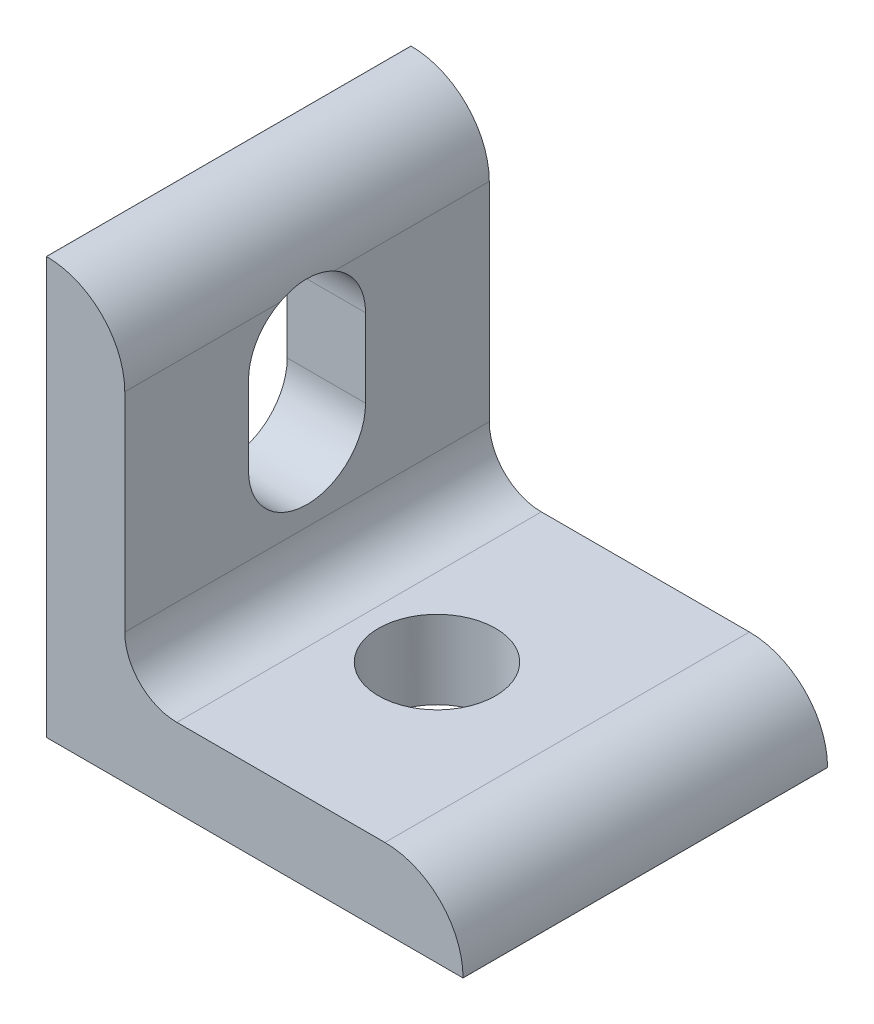
from build123d import *

# Parameters (mm, degrees)
BOSS_EXTRUDE1_DEPTH = 11.1125
CUT_EXTRUDE1_REACH  = 39.601
SKETCH4_R           = 3.5687
CUT_EXTRUDE2_DEPTH  = 38.600633818


with BuildPart() as part:
    # Sketch2 → Boss-Extrude1 (new, symmetric)
    with BuildSketch(Plane.XY):
        with BuildLine():
            Line((0, 0), (0, 25.4))
            Line((0, 25.4), (0.0127, 25.4))
            ThreePointArc((0.0127, 25.4), (3.380296045, 24.005096045), (4.7752, 20.6375))
            Line((4.7752, 20.6375), (4.7752, 7.9502))
            ThreePointArc((4.7752, 7.9502), (5.70513597, 5.70513597), (7.9502, 4.7752))
            Line((7.9502, 4.7752), (20.6375, 4.7752))
            ThreePointArc((20.6375, 4.7752), (24.005096045, 3.380296045), (25.4, 0.0127))
            Line((25.4, 0.0127), (25.4, 0))
            Line((25.4, 0), (0, 0))
        make_face()
    extrude(amount=BOSS_EXTRUDE1_DEPTH, both=True)

    # Sketch3 → Cut-Extrude1 (cut, up to next)
    with BuildSketch(Plane.ZY, mode=Mode.PRIVATE) as cut_extrude1_sk1:
        with BuildLine():
            Line((-3.5687, 17.4752), (-3.5687, 12.7))
            ThreePointArc((-3.5687, 12.7), (0, 9.1313), (3.5687, 12.7))
            Line((3.5687, 12.7), (3.5687, 17.4752))
            ThreePointArc((3.5687, 17.4752), (0, 21.0439), (-3.5687, 17.4752))
        make_face()
    cut_extrude1_tool1 = extrude(cut_extrude1_sk1.sketch, amount=-CUT_EXTRUDE1_REACH, mode=Mode.PRIVATE) & part.part
    add(cut_extrude1_tool1.solids().sort_by_distance((0, 15.0876, 0))[0], mode=Mode.SUBTRACT)

    # Sketch4 → Cut-Extrude2 (cut, through all)
    with BuildSketch(Plane.XZ):
        with Locations((12.7, 0)):
            Circle(SKETCH4_R)
    extrude(amount=-CUT_EXTRUDE2_DEPTH, mode=Mode.SUBTRACT)


solid = part.part
